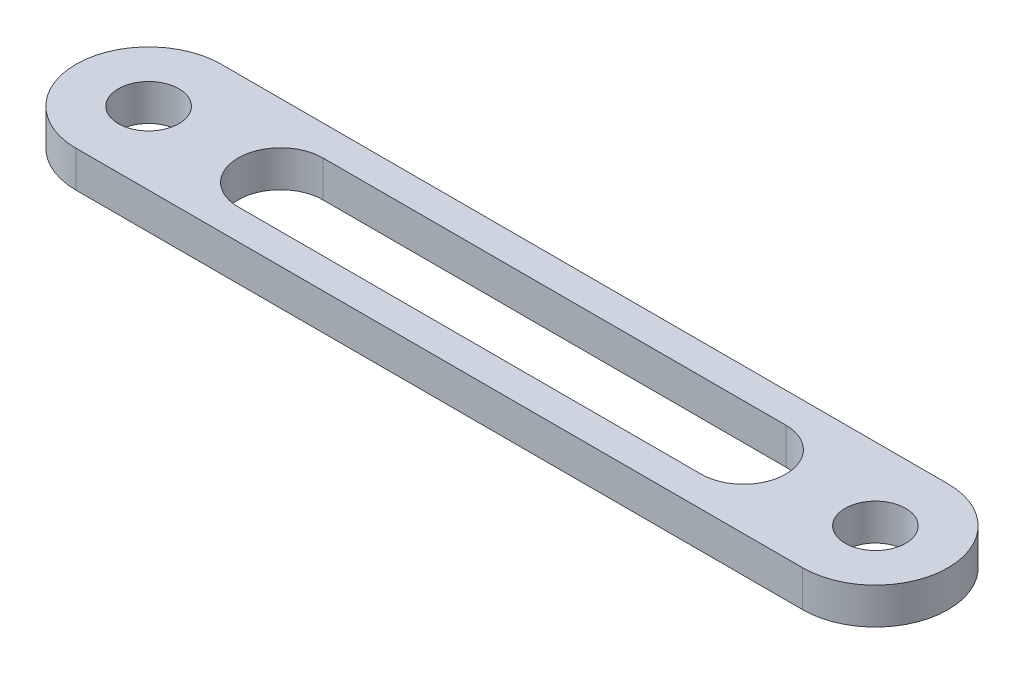
from build123d import *

# Parameters (mm, degrees)
SKETCH1_R           = 3.175
BOSS_EXTRUDE5_DEPTH = 3.81


with BuildPart() as part:
    # Sketch1 → Boss-Extrude5 (new body)
    with BuildSketch(Plane(origin=(0, 0, 0), x_dir=(1, 0, 0), z_dir=(0, 1, 0))):
        with BuildLine():
            Line((38.1, -7.62), (-38.1, -7.62))
            ThreePointArc((-38.1, -7.62), (-45.72, 0), (-38.1, 7.62))
            Line((-38.1, 7.62), (38.1, 7.62))
            ThreePointArc((38.1, 7.62), (45.72, 0), (38.1, -7.62))
        make_face()
        with Locations(Location((-38.1, 0, 0), (0, 0, 90))):
            Circle(SKETCH1_R, mode=Mode.SUBTRACT)
        with Locations(Location((38.1, 0, 0), (0, 0, 90))):
            Circle(SKETCH1_R, mode=Mode.SUBTRACT)
        with BuildLine():
            Line((-24.266853823, 4.445), (24.266853823, 4.445))
            ThreePointArc((24.266853823, 4.445), (28.711853823, 0), (24.266853823, -4.445))
            Line((24.266853823, -4.445), (-24.266853823, -4.445))
            ThreePointArc((-24.266853823, -4.445), (-28.711853823, 0), (-24.266853823, 4.445))
        make_face(mode=Mode.SUBTRACT)
    extrude(amount=BOSS_EXTRUDE5_DEPTH)


solid = part.part
